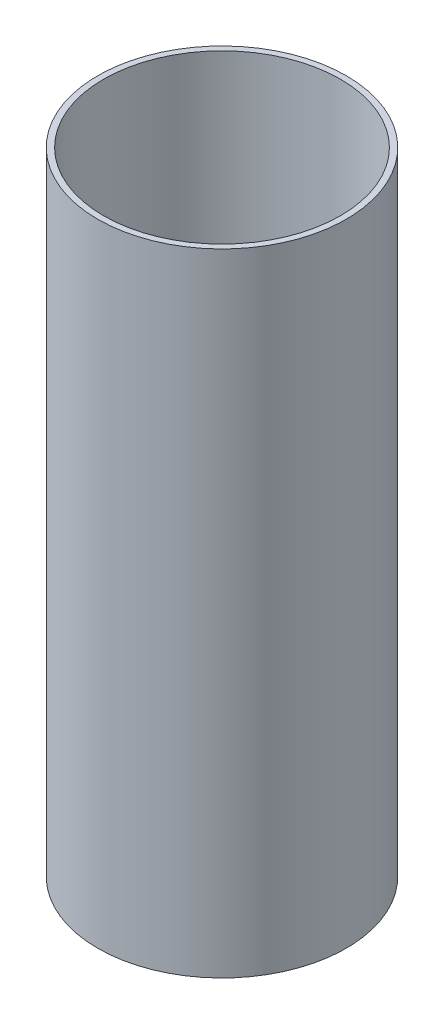
from build123d import *

# Parameters (mm, degrees)
SKETCH1_R           = 40.005
SKETCH1_R_2         = 38.1
BOSS_EXTRUDE1_DEPTH = 203.2


with BuildPart() as part:
    # Sketch1 → Boss-Extrude1 (new body)
    with BuildSketch(Plane(origin=(0, 0, 0), x_dir=(1, 0, 0), z_dir=(0, 1, 0))):
        with Locations(Location((0, 0, 0), (0, 0, 270))):
            Circle(SKETCH1_R)
        with Locations(Location((0, 0, 0), (0, 0, 270))):
            Circle(SKETCH1_R_2, mode=Mode.SUBTRACT)
    extrude(amount=BOSS_EXTRUDE1_DEPTH)


solid = part.part
